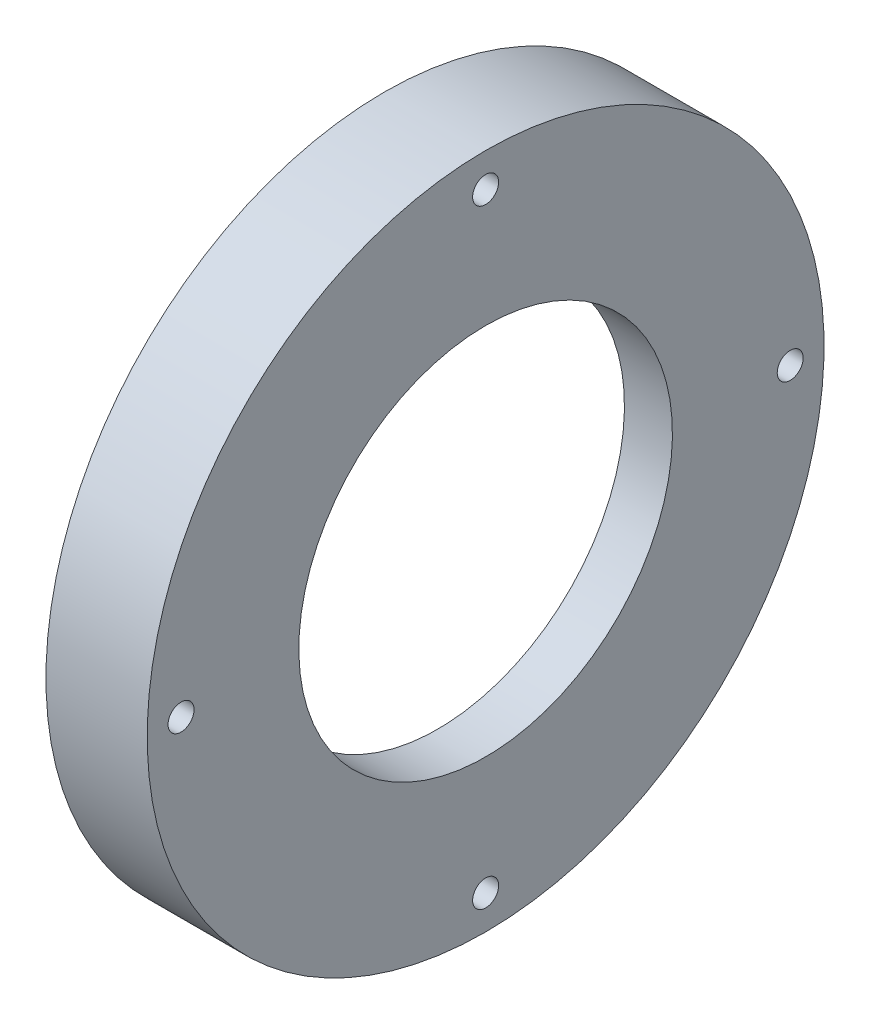
from build123d import *

# Parameters (mm, degrees)
CBORE_FOR_2_BINDING_HEAD_MACHINE_SCREW1_D           = 2.4384
CBORE_FOR_2_BINDING_HEAD_MACHINE_SCREW1_CBORE_D     = 5.55752
CBORE_FOR_2_BINDING_HEAD_MACHINE_SCREW1_CBORE_DEPTH = 5.269992


with BuildPart() as part:
    # Sketch13 → Revolve1 (revolve)
    with BuildSketch(Plane.XY, mode=Mode.PRIVATE) as revolve1_sk:
        with BuildLine():
            Line((0, -31.75), (-9.5, -31.75))
            ThreePointArc((-9.5, -31.75), (-5.964466094, -30.285533906), (-4.5, -26.75))
            Line((-4.5, -26.75), (-4.5, -17.526))
            Line((-4.5, -17.526), (0, -17.526))
            Line((0, -17.526), (0, -31.75))
        make_face()
    revolve(revolve1_sk.sketch.rotate(Axis((16.880780842, 0, 0), (-1, 0, 0)), 180), axis=Axis((16.880780842, 0, 0), (-1, 0, 0)))

    # CBORE for #2 Binding Head Machine Screw1 (through all)
    with Locations(Plane(origin=(-9.5, 0, 0), x_dir=(0, 0, -1), z_dir=(-1, 0, 0))):
        with Locations((-28.575, 0), (0, -28.575), (28.575, 0), (0, 28.575)):
            CounterBoreHole(CBORE_FOR_2_BINDING_HEAD_MACHINE_SCREW1_D / 2, CBORE_FOR_2_BINDING_HEAD_MACHINE_SCREW1_CBORE_D / 2, CBORE_FOR_2_BINDING_HEAD_MACHINE_SCREW1_CBORE_DEPTH)


solid = part.part
